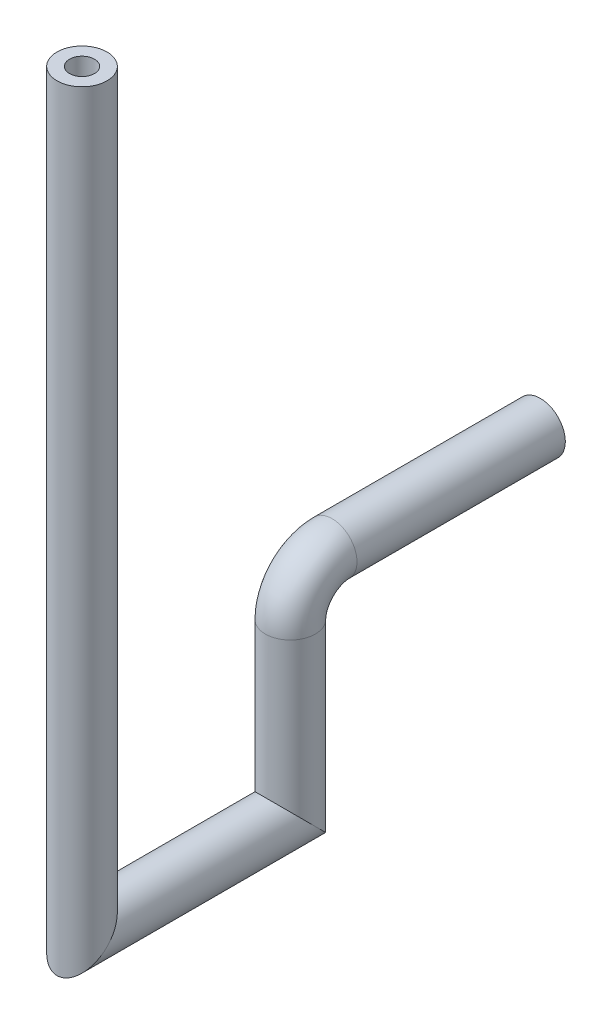
from build123d import *

# Parameters (mm, degrees)
ESBO_O1_R                   = 6
ESBO_O1_R_2                 = 3.5
RESSALTO_EXTRUS_O1_DEPTH    = 15
ESBO_O2_R                   = 6
ESBO_O2_R_2                 = 3
RESSALTO_EXTRUS_O2_DEPTH    = 30
VARREDURA_FINO1_PROFILE_R   = 6
VARREDURA_FINO1_PROFILE_R_2 = 3
CORTE_EXTRUS_O2_DEPTH       = 1
ESBO_O119_W                 = 4
ESBO_O119_H                 = 0.5
CORTE_EXTRUS_O3_DEPTH       = 0.5


with BuildPart() as part:
    # Esboço1 → Ressalto-extrusão1 (new body)
    with BuildSketch(Plane.XY):
        Circle(ESBO_O1_R)
        Circle(ESBO_O1_R_2, mode=Mode.SUBTRACT)
    extrude(amount=RESSALTO_EXTRUS_O1_DEPTH)

    # Esboço2 → Ressalto-extrusão2 (add)
    with BuildSketch(Plane.XY.offset(15)):
        Circle(ESBO_O2_R)
        Circle(ESBO_O2_R_2, mode=Mode.SUBTRACT)
    extrude(amount=RESSALTO_EXTRUS_O2_DEPTH)

    # Varredura-Fino1: sweep along a path in Esboço4
    with BuildLine(Plane.YZ) as varredura_fino1_path:
        Line((0, 45), (0, 50))
        ThreePointArc((0, 50), (-2.928932188, 57.071067812), (-10, 60))
        Line((-10, 60), (-50, 60))
        Line((-50, 60), (-50, 110))
        Line((-50, 110), (130, 110))
    # Varredura-Fino1 profile (on start of the path) → Varredura-Fino1 (sweep)
    with BuildSketch(Plane.XY.offset(45)):
        Circle(VARREDURA_FINO1_PROFILE_R)
        Circle(VARREDURA_FINO1_PROFILE_R_2, mode=Mode.SUBTRACT)
    sweep(path=varredura_fino1_path.line, transition=Transition.RIGHT)

    # Esboço114 → Corte-extrusão2 (cut)
    with BuildSketch(Plane(origin=(-6, -37, 0), x_dir=(0, -1, 0), z_dir=(1, 0, 0))):
        Polygon((-6.25, -60), (-6.25, -45.570065925), (-5.75, -45.570065925), (-5.75, -60), (-5.75, -84.564337874), (-6.25, -84.564337874), align=None)
        Polygon((-6.25, -110), (-6.25, -131.421196811), (-5.75, -131.421196811), (-5.75, -110), (-5.75, -90.449776492), (-6.25, -90.449776492), align=None)
        Polygon((-16.25, -90.449776492), (-16.25, -110), (-16.25, -131.421196811), (-15.75, -131.421196811), (-15.75, -110), (-15.75, -90.449776492), align=None)
        Polygon((-26.25, -90.449776492), (-26.25, -110), (-26.25, -131.421196811), (-25.75, -131.421196811), (-25.75, -110), (-25.75, -90.449776492), align=None)
        Polygon((-36.25, -90.449776492), (-36.25, -110), (-36.25, -131.421196811), (-35.75, -131.421196811), (-35.75, -110), (-35.75, -90.449776492), align=None)
        Polygon((-46.25, -90.449776492), (-46.25, -110), (-46.25, -131.421196811), (-45.75, -131.421196811), (-45.75, -110), (-45.75, -90.449776492), align=None)
        Polygon((-56.25, -90.449776492), (-56.25, -110), (-56.25, -131.421196811), (-55.75, -131.421196811), (-55.75, -110), (-55.75, -90.449776492), align=None)
        Polygon((-66.25, -90.449776492), (-66.25, -110), (-66.25, -131.421196811), (-65.75, -131.421196811), (-65.75, -110), (-65.75, -90.449776492), align=None)
        Polygon((-76.25, -90.449776492), (-76.25, -110), (-76.25, -131.421196811), (-75.75, -131.421196811), (-75.75, -110), (-75.75, -90.449776492), align=None)
        Polygon((-86.25, -90.449776492), (-86.25, -110), (-86.25, -131.421196811), (-85.75, -131.421196811), (-85.75, -110), (-85.75, -90.449776492), align=None)
        Polygon((-96.25, -90.449776492), (-96.25, -110), (-96.25, -131.421196811), (-95.75, -131.421196811), (-95.75, -110), (-95.75, -90.449776492), align=None)
        Polygon((-106.25, -90.449776492), (-105.75, -90.449776492), (-105.75, -110), (-105.75, -131.421196811), (-106.25, -131.421196811), (-106.25, -110), align=None)
    extrude(amount=CORTE_EXTRUS_O2_DEPTH, mode=Mode.SUBTRACT)

    # Esboço119 → Corte-extrusão3 (cut)
    with BuildSketch(Plane(origin=(-6, 0, 0), x_dir=(0, 0, -1), z_dir=(1, 0, 0))):
        with Locations((-110, -31)):
            Rectangle(ESBO_O119_W, ESBO_O119_H)
        with Locations((-110, -30)):
            Rectangle(ESBO_O119_W, ESBO_O119_H)
        with Locations((-110, -29)):
            Rectangle(ESBO_O119_W, ESBO_O119_H)
        with Locations((-110, -28)):
            Rectangle(ESBO_O119_W, ESBO_O119_H)
        with Locations((-110, -27)):
            Rectangle(ESBO_O119_W, ESBO_O119_H)
        with Locations((-110, -26)):
            Rectangle(ESBO_O119_W, ESBO_O119_H)
        with Locations((-110, -25)):
            Rectangle(ESBO_O119_W, ESBO_O119_H)
        with Locations((-110, -24)):
            Rectangle(ESBO_O119_W, ESBO_O119_H)
        with Locations((-110, -23)):
            Rectangle(ESBO_O119_W, ESBO_O119_H)
        with Locations((-110, -22)):
            Rectangle(ESBO_O119_W, ESBO_O119_H)
        with Locations((-110, -21)):
            Rectangle(ESBO_O119_W, ESBO_O119_H)
        with Locations((-110, -20)):
            Rectangle(ESBO_O119_W, ESBO_O119_H)
        with Locations((-110, -19)):
            Rectangle(ESBO_O119_W, ESBO_O119_H)
        with Locations((-110, -18)):
            Rectangle(ESBO_O119_W, ESBO_O119_H)
        with Locations((-110, -17)):
            Rectangle(ESBO_O119_W, ESBO_O119_H)
        with Locations((-110, -16)):
            Rectangle(ESBO_O119_W, ESBO_O119_H)
        with Locations((-110, -15)):
            Rectangle(ESBO_O119_W, ESBO_O119_H)
        with Locations((-110, -14)):
            Rectangle(ESBO_O119_W, ESBO_O119_H)
        with Locations((-110, -13)):
            Rectangle(ESBO_O119_W, ESBO_O119_H)
        with Locations((-110, -12)):
            Rectangle(ESBO_O119_W, ESBO_O119_H)
        with Locations((-110, -11)):
            Rectangle(ESBO_O119_W, ESBO_O119_H)
        with Locations((-110, -10)):
            Rectangle(ESBO_O119_W, ESBO_O119_H)
        with Locations((-110, -9)):
            Rectangle(ESBO_O119_W, ESBO_O119_H)
        with Locations((-110, -8)):
            Rectangle(ESBO_O119_W, ESBO_O119_H)
        with Locations((-110, -7)):
            Rectangle(ESBO_O119_W, ESBO_O119_H)
        with Locations((-110, -6)):
            Rectangle(ESBO_O119_W, ESBO_O119_H)
        with Locations((-110, -5)):
            Rectangle(ESBO_O119_W, ESBO_O119_H)
        with Locations((-110, -4)):
            Rectangle(ESBO_O119_W, ESBO_O119_H)
        with Locations((-110, -3)):
            Rectangle(ESBO_O119_W, ESBO_O119_H)
        with Locations((-110, -2)):
            Rectangle(ESBO_O119_W, ESBO_O119_H)
        with Locations((-110, -1)):
            Rectangle(ESBO_O119_W, ESBO_O119_H)
        with Locations((-110, 0)):
            Rectangle(ESBO_O119_W, ESBO_O119_H)
        with Locations((-110, 1)):
            Rectangle(ESBO_O119_W, ESBO_O119_H)
        with Locations((-110, 2)):
            Rectangle(ESBO_O119_W, ESBO_O119_H)
        with Locations((-110, 3)):
            Rectangle(ESBO_O119_W, ESBO_O119_H)
        with Locations((-110, 4)):
            Rectangle(ESBO_O119_W, ESBO_O119_H)
        with Locations((-110, 5)):
            Rectangle(ESBO_O119_W, ESBO_O119_H)
        with Locations((-110, 6)):
            Rectangle(ESBO_O119_W, ESBO_O119_H)
        with Locations((-110, 7)):
            Rectangle(ESBO_O119_W, ESBO_O119_H)
        with Locations((-110, 8)):
            Rectangle(ESBO_O119_W, ESBO_O119_H)
        with Locations((-110, 9)):
            Rectangle(ESBO_O119_W, ESBO_O119_H)
        with Locations((-110, 10)):
            Rectangle(ESBO_O119_W, ESBO_O119_H)
        with Locations((-110, 11)):
            Rectangle(ESBO_O119_W, ESBO_O119_H)
        with Locations((-110, 12)):
            Rectangle(ESBO_O119_W, ESBO_O119_H)
        with Locations((-110, 13)):
            Rectangle(ESBO_O119_W, ESBO_O119_H)
        with Locations((-110, 14)):
            Rectangle(ESBO_O119_W, ESBO_O119_H)
        with Locations((-110, 15)):
            Rectangle(ESBO_O119_W, ESBO_O119_H)
        with Locations((-110, 16)):
            Rectangle(ESBO_O119_W, ESBO_O119_H)
        with Locations((-110, 17)):
            Rectangle(ESBO_O119_W, ESBO_O119_H)
        with Locations((-110, 18)):
            Rectangle(ESBO_O119_W, ESBO_O119_H)
        with Locations((-110, 19)):
            Rectangle(ESBO_O119_W, ESBO_O119_H)
        with Locations((-110, 20)):
            Rectangle(ESBO_O119_W, ESBO_O119_H)
        with Locations((-110, 21)):
            Rectangle(ESBO_O119_W, ESBO_O119_H)
        with Locations((-110, 22)):
            Rectangle(ESBO_O119_W, ESBO_O119_H)
        with Locations((-110, 23)):
            Rectangle(ESBO_O119_W, ESBO_O119_H)
        with Locations((-110, 24)):
            Rectangle(ESBO_O119_W, ESBO_O119_H)
        with Locations((-110, 25)):
            Rectangle(ESBO_O119_W, ESBO_O119_H)
        with Locations((-110, 26)):
            Rectangle(ESBO_O119_W, ESBO_O119_H)
        with Locations((-110, 27)):
            Rectangle(ESBO_O119_W, ESBO_O119_H)
        with Locations((-110, 28)):
            Rectangle(ESBO_O119_W, ESBO_O119_H)
        with Locations((-110, 29)):
            Rectangle(ESBO_O119_W, ESBO_O119_H)
        with Locations((-110, 30)):
            Rectangle(ESBO_O119_W, ESBO_O119_H)
        with Locations((-110, 31)):
            Rectangle(ESBO_O119_W, ESBO_O119_H)
        with Locations((-110, 32)):
            Rectangle(ESBO_O119_W, ESBO_O119_H)
        with Locations((-110, 33)):
            Rectangle(ESBO_O119_W, ESBO_O119_H)
        with Locations((-110, 34)):
            Rectangle(ESBO_O119_W, ESBO_O119_H)
        with Locations((-110, 35)):
            Rectangle(ESBO_O119_W, ESBO_O119_H)
        with Locations((-110, 36)):
            Rectangle(ESBO_O119_W, ESBO_O119_H)
        with Locations((-110, 37)):
            Rectangle(ESBO_O119_W, ESBO_O119_H)
        with Locations((-110, 38)):
            Rectangle(ESBO_O119_W, ESBO_O119_H)
        with Locations((-110, 39)):
            Rectangle(ESBO_O119_W, ESBO_O119_H)
        with Locations((-110, 40)):
            Rectangle(ESBO_O119_W, ESBO_O119_H)
        with Locations((-110, 41)):
            Rectangle(ESBO_O119_W, ESBO_O119_H)
        with Locations((-110, 42)):
            Rectangle(ESBO_O119_W, ESBO_O119_H)
        with Locations((-110, 43)):
            Rectangle(ESBO_O119_W, ESBO_O119_H)
        with Locations((-110, 44)):
            Rectangle(ESBO_O119_W, ESBO_O119_H)
        with Locations((-110, 45)):
            Rectangle(ESBO_O119_W, ESBO_O119_H)
        with Locations((-110, 46)):
            Rectangle(ESBO_O119_W, ESBO_O119_H)
        with Locations((-110, 47)):
            Rectangle(ESBO_O119_W, ESBO_O119_H)
        with Locations((-110, 48)):
            Rectangle(ESBO_O119_W, ESBO_O119_H)
        with Locations((-110, 49)):
            Rectangle(ESBO_O119_W, ESBO_O119_H)
        with Locations((-110, 50)):
            Rectangle(ESBO_O119_W, ESBO_O119_H)
        with Locations((-110, 51)):
            Rectangle(ESBO_O119_W, ESBO_O119_H)
        with Locations((-110, 52)):
            Rectangle(ESBO_O119_W, ESBO_O119_H)
        with Locations((-110, 53)):
            Rectangle(ESBO_O119_W, ESBO_O119_H)
        with Locations((-110, 54)):
            Rectangle(ESBO_O119_W, ESBO_O119_H)
        with Locations((-110, 55)):
            Rectangle(ESBO_O119_W, ESBO_O119_H)
        with Locations((-110, 56)):
            Rectangle(ESBO_O119_W, ESBO_O119_H)
        with Locations((-110, 57)):
            Rectangle(ESBO_O119_W, ESBO_O119_H)
        with Locations((-110, 58)):
            Rectangle(ESBO_O119_W, ESBO_O119_H)
        with Locations((-110, 59)):
            Rectangle(ESBO_O119_W, ESBO_O119_H)
        with Locations((-110, 60)):
            Rectangle(ESBO_O119_W, ESBO_O119_H)
        with Locations((-110, 61)):
            Rectangle(ESBO_O119_W, ESBO_O119_H)
        with Locations((-110, 62)):
            Rectangle(ESBO_O119_W, ESBO_O119_H)
        with Locations((-110, 63)):
            Rectangle(ESBO_O119_W, ESBO_O119_H)
        with Locations((-110, 64)):
            Rectangle(ESBO_O119_W, ESBO_O119_H)
        with Locations((-110, 65)):
            Rectangle(ESBO_O119_W, ESBO_O119_H)
        with Locations((-110, 66)):
            Rectangle(ESBO_O119_W, ESBO_O119_H)
        with Locations((-110, 67)):
            Rectangle(ESBO_O119_W, ESBO_O119_H)
        with Locations((-110, 68)):
            Rectangle(ESBO_O119_W, ESBO_O119_H)
        with Locations((-110, 69)):
            Rectangle(ESBO_O119_W, ESBO_O119_H)
    extrude(amount=CORTE_EXTRUS_O3_DEPTH, mode=Mode.SUBTRACT)


solid = part.part
